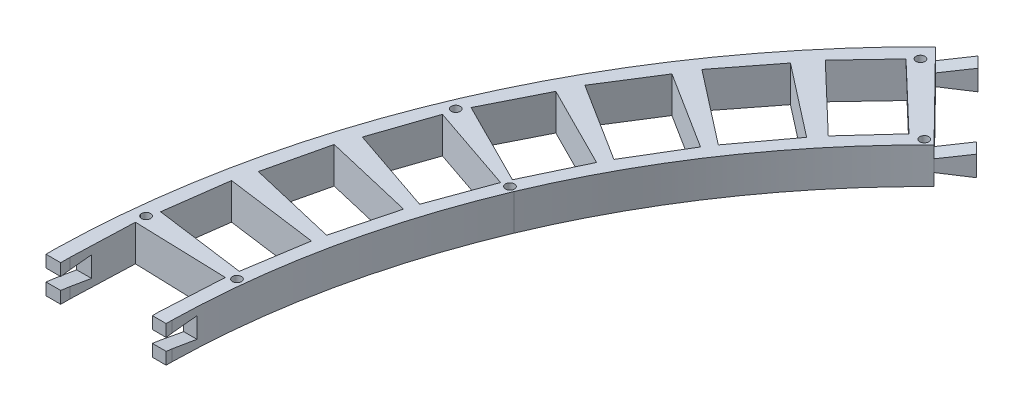
from build123d import *

# Parameters (mm, degrees)
SKETCH1_R           = 1.500000001
SKETCH1_R_2         = 1.5
BOSS_EXTRUDE1_DEPTH = 12
SKETCH6_W           = 31
SKETCH6_H           = 1
BOSS_EXTRUDE2_DEPTH = 1
SKETCH7_W           = 31
SKETCH7_H           = 1
BOSS_EXTRUDE3_DEPTH = 1
SKETCH8_W           = 28
SKETCH8_H           = 1
BOSS_EXTRUDE4_DEPTH = 0.75
SKETCH9_W           = 28
SKETCH9_H           = 1
BOSS_EXTRUDE5_DEPTH = 0.75
CUT_EXTRUDE5_DEPTH  = 41
BOSS_EXTRUDE6_DEPTH = 5


with BuildPart() as part:
    # Sketch1 → Boss-Extrude1 (new body)
    with BuildSketch(Plane(origin=(0, 0, 0), x_dir=(1, 0, 0), z_dir=(0, 1, 0))):
        with BuildLine():
            Line((-206.901303799, 210.544296342), (-178.864917553, 182.014262429))
            ThreePointArc((-178.864917553, 182.014262429), (-211.248528729, 143.160707083), (-235.332727793, 98.683202756))
            ThreePointArc((-235.332727793, 98.683202756), (-249.691560201, 52.678328759), (-255.14463702, 4.794213931))
            Line((-255.14463702, 4.794213931), (-255.14463702, 2.779626552))
            Line((-255.14463702, 2.779626552), (-259.725038425, 2.779626552))
            Line((-259.725038425, 2.779626552), (-259.725038425, 4.938563385))
            Line((-259.725038425, 4.938563385), (-258.586614607, 25.913112119))
            Line((-258.586614607, 25.913112119), (-289.472992235, 26.886483517))
            Line((-289.472992235, 26.886483517), (-290.232709847, 5.900000013))
            Line((-290.232709847, 5.900000013), (-290.232709847, 2.779626551))
            Line((-290.232709847, 2.779626551), (-295.127762341, 2.779626551))
            Line((-295.127762341, 2.779626551), (-295.127762341, 6.054265565))
            ThreePointArc((-295.127762341, 6.054265565), (-271.03936796, 116.93892103), (-206.901303799, 210.544296342))
        make_face()
        with Locations(Location((-205.923171716, 204.555428223, 0), (0, 0, 270))):
            Circle(SKETCH1_R, mode=Mode.SUBTRACT)
        with Locations(Location((-182.123524849, 182.048793456, 0), (0, 0, 270))):
            Circle(SKETCH1_R_2, mode=Mode.SUBTRACT)
        with Locations(Location((-289.472992235, 30.413510705, 0), (0, 0, 270))):
            Circle(SKETCH1_R_2, mode=Mode.SUBTRACT)
        with Locations(Location((-256.189573648, 27.390600482, 0), (0, 0, 270))):
            Circle(SKETCH1_R_2, mode=Mode.SUBTRACT)
        with Locations(Location((-237.445118633, 99.492127605, 0), (0, 0, 270))):
            Circle(SKETCH1_R_2, mode=Mode.SUBTRACT)
        with Locations(Location((-268.833815416, 112.841343478, 0), (0, 0, 270))):
            Circle(SKETCH1_R_2, mode=Mode.SUBTRACT)
        Polygon((-288.286547304, 34.069084362), (-258.033222279, 30.008925637), (-254.767009525, 50.758854735), (-285.491553173, 54.882253531), align=None, mode=Mode.SUBTRACT)
        Polygon((-283.612878523, 61.915838046), (-253.89939669, 54.933619681), (-248.631031599, 75.267631401), (-278.809043274, 82.359007245), align=None, mode=Mode.SUBTRACT)
        Polygon((-276.255921554, 89.176800074), (-247.361344598, 79.340855863), (-240.142390382, 99.066838813), (-269.488694715, 109.056554622), align=None, mode=Mode.SUBTRACT)
        Polygon((-229.967759139, 120.819849226), (-238.977493449, 101.844802692), (-266.671759318, 115.77418308), (-257.235727442, 134.534814797), align=None, mode=Mode.SUBTRACT)
        Polygon((-217.141868251, 142.590375773), (-227.952465343, 124.580414811), (-254.16244031, 141.134484167), (-242.948393328, 158.889628499), align=None, mode=Mode.SUBTRACT)
        Polygon((-202.261755682, 163.008777697), (-214.772333152, 146.135332444), (-239.248466479, 165.159498585), (-226.362501502, 181.741172494), align=None, mode=Mode.SUBTRACT)
        Polygon((-185.566118156, 181.787515485), (-199.72829266, 166.274278663), (-222.071098467, 187.621756348), (-207.634972794, 202.873245989), align=None, mode=Mode.SUBTRACT)
    extrude(amount=BOSS_EXTRUDE1_DEPTH)

    # Sketch6 → Boss-Extrude2 (add)
    with BuildSketch(Plane(origin=(2.241673695, 0, -2.346191939), x_dir=(0.7230281012906209, 0, 0.6908186192801116), z_dir=(-0.6908186192801116, 0, 0.7230281012906209))):
        with Locations((-275.013127173, 11.5)):
            Rectangle(SKETCH6_W, SKETCH6_H)
    extrude(amount=BOSS_EXTRUDE2_DEPTH)

    # Sketch7 → Boss-Extrude3 (add)
    with BuildSketch(Plane(origin=(-12.265517311, 0, 12.83739819), x_dir=(-0.7230281012906384, 0, -0.6908186192800932), z_dir=(0.6908186192800932, 0, -0.7230281012906384))):
        with Locations((274.725391583, 11.5)):
            Rectangle(SKETCH7_W, SKETCH7_H)
    extrude(amount=BOSS_EXTRUDE3_DEPTH)

    # Sketch8 → Boss-Extrude4 (add)
    with BuildSketch(Plane(origin=(-12.265517311, 0, 12.83739819), x_dir=(-0.7230281012906384, 0, -0.6908186192800932), z_dir=(0.6908186192800932, 0, -0.7230281012906384))):
        with Locations((274.725391583, 0.5)):
            Rectangle(SKETCH8_W, SKETCH8_H)
    extrude(amount=BOSS_EXTRUDE4_DEPTH)

    # Sketch9 → Boss-Extrude5 (add)
    with BuildSketch(Plane(origin=(2.241673695, 0, -2.346191939), x_dir=(0.7230281012906209, 0, 0.6908186192801116), z_dir=(-0.6908186192801116, 0, 0.7230281012906209))):
        with Locations((-274.86046651, 0.5)):
            Rectangle(SKETCH9_W, SKETCH9_H)
    extrude(amount=BOSS_EXTRUDE5_DEPTH)

    # Sketch10 → Cut-Extrude5 (cut)
    with BuildSketch(Plane.ZY.offset(295.127762341)):
        Polygon((-2.779626551, 12), (-2.779626551, 8), (-12.781334045, 9.40564832), (-12.781334045, 2.59435168), (-2.779626551, 4), (-2.779626551, 0), (4.575602147, 0), (4.575602147, 12), align=None)
    extrude(amount=-CUT_EXTRUDE5_DEPTH, mode=Mode.SUBTRACT)

    # Sketch12 → Boss-Extrude6 (add)
    with BuildSketch(Plane(origin=(-206.901303799, 0, -210.544296342), x_dir=(-0.7132504491210117, 0, 0.700909264333605), z_dir=(-0.700909264333605, 0, -0.7132504491210117))):
        Polygon((0, 12), (0, 8), (-10, 9.417744688), (-10, 2.617744688), (0, 4.035489376), (0, 0), (0.901744135, 0), (0.901744135, 12), align=None)
    boss_extrude6 = extrude(amount=-BOSS_EXTRUDE6_DEPTH)

    # Mirror2: Boss-Extrude6 across plane
    add(boss_extrude6.mirror(Plane(origin=(-192.883118513, 0, -196.27928736), x_dir=(-0.7132504491210118, 0, 0.7009092643336048), z_dir=(-0.700909264333605, 0, -0.7132504491210117))))


solid = part.part
